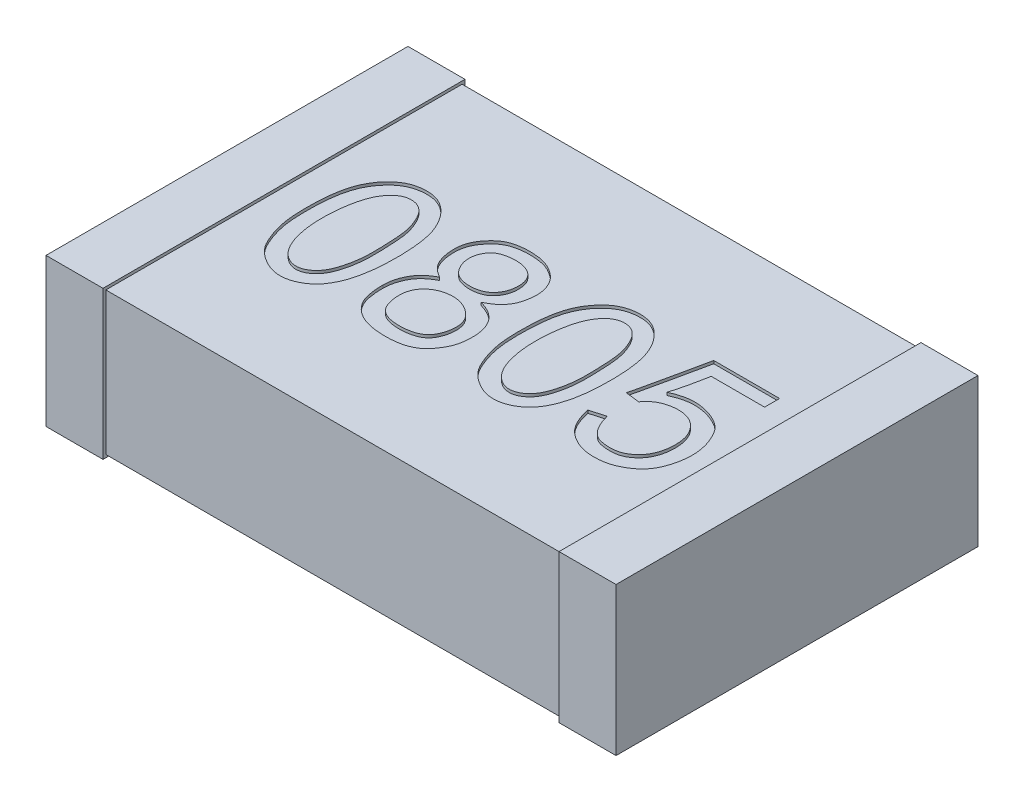
from build123d import *

# Parameters (mm, degrees)
SKETCH_1_W          = 2
SKETCH_1_H          = 1.25
EXTRUDE_1_DEPTH     = 0.5
SKETCH_2_W          = 1.27
SKETCH_2_H          = 0.52
EXTRUDE_2_DEPTH     = 0.2
SKETCH_3_W          = 1.27
SKETCH_3_H          = 0.52
EXTRUDE_3_DEPTH     = 0.2
CUT_EXTRUDE_1_DEPTH = 0.01


with BuildPart() as part:
    # 草图1 → 凸台-拉伸1 (new body)
    with BuildSketch(Plane(origin=(0, 0, 0), x_dir=(1, 0, 0), z_dir=(0, 1, 0))):
        Rectangle(SKETCH_1_W, SKETCH_1_H)
    extrude(amount=EXTRUDE_1_DEPTH)

    # 草图2 → 凸台-拉伸2 (add)
    with BuildSketch(Plane.ZY.offset(1)):
        with Locations((0, 0.25)):
            Rectangle(SKETCH_2_W, SKETCH_2_H)
    extrude(amount=-EXTRUDE_2_DEPTH)

    # 草图3 → 凸台-拉伸3 (add)
    with BuildSketch(Plane(origin=(1, 0, 0), x_dir=(0, 0, -1), z_dir=(1, 0, 0))):
        with Locations((0, 0.25)):
            Rectangle(SKETCH_3_W, SKETCH_3_H)
    extrude(amount=-EXTRUDE_3_DEPTH)

    # 草图4 → 切除-拉伸1 (cut)
    # profile 1 of 4: a face of its own
    with BuildSketch(Plane(origin=(0, 0.5, 0), x_dir=(1, 0, 0), z_dir=(0, 1, 0))):
        with BuildLine():
            add(Edge.make_bspline(
                [(-0.697551724, 0.012086435), (-0.697273285, 0.018370502), (-0.696730214, 0.030627027), (-0.695161169, 0.048498422), (-0.693266387, 0.065412192), (-0.69080292, 0.081316611), (-0.6877582, 0.09615874), (-0.68431195, 0.110016365), (-0.680329265, 0.122850712), (-0.674464846, 0.138525208), (-0.66567087, 0.156566364), (-0.653092049, 0.176394886), (-0.638475041, 0.194219333), (-0.624646887, 0.207279888), (-0.612656941, 0.216471968), (-0.603077204, 0.222440088), (-0.593012784, 0.227539397), (-0.582430676, 0.231697991), (-0.57135034, 0.234795743), (-0.559801131, 0.23708278), (-0.547744932, 0.238497576), (-0.535321613, 0.238918496), (-0.522804682, 0.238329132), (-0.510508589, 0.236409151), (-0.498643075, 0.233000694), (-0.487200036, 0.228321421), (-0.476210616, 0.222309135), (-0.465619495, 0.21501213), (-0.455552235, 0.206241697), (-0.445883363, 0.196353957), (-0.436852354, 0.185471712), (-0.428579969, 0.173804982), (-0.421100573, 0.161474107), (-0.41451386, 0.148411439), (-0.408609653, 0.134732164), (-0.403656549, 0.120314435), (-0.399558709, 0.105216828), (-0.395046346, 0.08388881), (-0.391076445, 0.055597746), (-0.388279599, 0.019792076), (-0.387641402, -0.018386797), (-0.388591689, -0.051403705), (-0.390383002, -0.078155018), (-0.392419526, -0.097558078), (-0.395154932, -0.115972347), (-0.398339269, -0.133487456), (-0.402323068, -0.15001026), (-0.407043913, -0.165558463), (-0.412144574, -0.180233637), (-0.418148327, -0.193881523), (-0.424687356, -0.206618025), (-0.432142408, -0.218279995), (-0.440218917, -0.229024955), (-0.44913098, -0.238767754), (-0.458994708, -0.247312134), (-0.469466928, -0.255070392), (-0.480828878, -0.261673544), (-0.492777795, -0.267276961), (-0.50508428, -0.271736567), (-0.517594692, -0.274643206), (-0.53007303, -0.276370796), (-0.542607227, -0.276377116), (-0.55512302, -0.275287325), (-0.56756901, -0.272420568), (-0.580098714, -0.268479087), (-0.59237652, -0.262905087), (-0.604193618, -0.256486906), (-0.615316658, -0.249579015), (-0.625441662, -0.242062239), (-0.63464953, -0.234034941), (-0.643055126, -0.22556452), (-0.650559253, -0.216570563), (-0.657084022, -0.207028167), (-0.664375332, -0.193598514), (-0.672186654, -0.176275889), (-0.680271328, -0.154938575), (-0.68687896, -0.133088019), (-0.691127802, -0.114310704), (-0.693929058, -0.098602045), (-0.695470314, -0.085724854), (-0.696809127, -0.071863065), (-0.697618267, -0.057013447), (-0.698156481, -0.041163126), (-0.698390721, -0.02430081), (-0.698140008, -0.006428462), (-0.697751281, 0.005805843), (-0.697551724, 0.012086435)],
                knots=[0, 0, 0, 0, 1.18043416, 2.302333746, 3.366253517, 4.374302266, 5.321670991, 6.208995316, 7.053297808, 7.84229274, 9.348259463, 10.810477328, 12.240076564, 13.663562249, 14.3695339, 15.072606272, 15.778577923, 16.484387009, 17.202829605, 17.934942377, 18.692112664, 19.478485278, 20.265441384, 21.040673806, 21.808439453, 22.577161074, 23.356320991, 24.155029842, 24.986154494, 25.858111265, 26.748121484, 27.637306138, 28.540117759, 29.452135788, 30.380885827, 31.334339875, 32.310628684, 33.31521083, 35.42407972, 37.666773946, 40.052062172, 42.587025658, 43.863776122, 45.083322308, 46.247467896, 47.357025429, 48.423487632, 49.435172604, 50.405897663, 51.337337341, 52.231284254, 53.090220275, 53.931690991, 54.751583713, 55.562922169, 56.377338113, 57.194202079, 58.024663732, 58.851830165, 59.645552351, 60.431282623, 61.21044254, 61.99312915, 62.783838437, 63.60230231, 64.454612977, 65.309477934, 66.125301685, 66.909862715, 67.67340185, 68.415973016, 69.147238889, 69.868837108, 70.581506411, 72.0124375, 73.431838244, 74.861437481, 76.292961888, 77.042577341, 77.855187732, 78.726196438, 79.655959089, 80.645695907, 81.702690171, 82.820655125, 84, 84, 84, 84], degree=3))
        make_face()
        with BuildLine():
            add(Edge.make_bspline(
                [(-0.636148216, 0.029630295), (-0.636812051, 0.023028505), (-0.638119831, 0.01002275), (-0.639189436, -0.009271034), (-0.639494245, -0.028018652), (-0.639215123, -0.046227686), (-0.638138697, -0.063862507), (-0.636302132, -0.080957243), (-0.633686, -0.097499894), (-0.630484086, -0.113446593), (-0.626647751, -0.12854246), (-0.622098166, -0.142582398), (-0.616919643, -0.155464127), (-0.61119098, -0.167207052), (-0.604902659, -0.177825192), (-0.597937584, -0.187258251), (-0.590491167, -0.195706903), (-0.582340871, -0.202806994), (-0.573981557, -0.208769539), (-0.565435089, -0.21340238), (-0.556840855, -0.216685213), (-0.548166053, -0.21869248), (-0.539441951, -0.219333388), (-0.530665069, -0.218712576), (-0.521900332, -0.216545779), (-0.513191274, -0.21322486), (-0.504787762, -0.208650908), (-0.496837745, -0.203127839), (-0.489506984, -0.196532112), (-0.482791604, -0.188934524), (-0.476730003, -0.180288081), (-0.471183747, -0.1707406), (-0.466313713, -0.160133725), (-0.460586972, -0.144603367), (-0.454819597, -0.123921092), (-0.44968852, -0.098076822), (-0.446662085, -0.071124618), (-0.445868586, -0.043471665), (-0.446384518, -0.015995037), (-0.447003315, 0.01062221), (-0.448491233, 0.035930332), (-0.450271976, 0.0600582), (-0.453294063, 0.083113537), (-0.458863368, 0.104975587), (-0.466664328, 0.12570363), (-0.474671168, 0.142066309), (-0.482344699, 0.153943772), (-0.488393923, 0.161913208), (-0.495119117, 0.168572627), (-0.502210444, 0.174249821), (-0.509832864, 0.178571987), (-0.517917445, 0.181805069), (-0.526460656, 0.183808636), (-0.535333027, 0.184796557), (-0.544271637, 0.184623855), (-0.55305151, 0.183054961), (-0.561567097, 0.180311184), (-0.569871981, 0.176405083), (-0.577791916, 0.171118283), (-0.5854535, 0.164647733), (-0.592770418, 0.156884475), (-0.599978053, 0.148039205), (-0.606552671, 0.13776812), (-0.612633031, 0.126262575), (-0.618025178, 0.113374741), (-0.622854403, 0.099179209), (-0.627191513, 0.083676749), (-0.63083815, 0.066858036), (-0.633864215, 0.048709664), (-0.635369528, 0.036135052), (-0.636148216, 0.029630295)],
                knots=[0, 0, 0, 0, 1.378198314, 2.715098627, 4.012594964, 5.272602849, 6.497213731, 7.681415101, 8.842769074, 9.975170128, 11.059162755, 12.076494648, 13.038717388, 13.940857576, 14.788360499, 15.598271168, 16.373595835, 17.122768248, 17.838466736, 18.502782022, 19.136468245, 19.744060339, 20.345653328, 20.947246317, 21.563841626, 22.214212994, 22.87852828, 23.546305104, 24.220743313, 24.921956094, 25.648106704, 26.41081768, 27.212668989, 28.069279432, 29.84713992, 31.666334073, 33.537864714, 35.473745168, 37.408579624, 39.246547954, 41.003985019, 42.674193204, 44.272363647, 45.827394737, 47.348405091, 48.867584295, 49.599750274, 50.283750763, 50.94125936, 51.560811542, 52.165388272, 52.754418158, 53.363720025, 53.982318455, 54.604903792, 55.213928724, 55.828148287, 56.458765578, 57.113918044, 57.800421407, 58.537638978, 59.326979919, 60.167286366, 61.066273245, 62.027297208, 63.065989643, 64.179487018, 65.369443928, 66.639232213, 68, 68, 68, 68], degree=3))
        make_face(mode=Mode.SUBTRACT)
    # profile 2 of 4: a face of its own
    with BuildSketch(Plane(origin=(0, 0.5, 0), x_dir=(1, 0, 0), z_dir=(0, 1, 0))):
        with BuildLine():
            add(Edge.make_bspline(
                [(0.050986287, 0.012086435), (0.051264726, 0.018370502), (0.051807798, 0.030627027), (0.053376843, 0.048498422), (0.055271625, 0.065412192), (0.057735091, 0.081316611), (0.060779812, 0.09615874), (0.064226062, 0.110016365), (0.068208746, 0.122850712), (0.074073165, 0.138525208), (0.082867142, 0.156566364), (0.095445963, 0.176394886), (0.11006297, 0.194219333), (0.123891125, 0.207279888), (0.13588107, 0.216471968), (0.145460808, 0.222440088), (0.155525228, 0.227539397), (0.166107336, 0.231697991), (0.177187672, 0.234795743), (0.188736881, 0.23708278), (0.20079308, 0.238497576), (0.213216399, 0.238918496), (0.22573333, 0.238329132), (0.238029422, 0.236409151), (0.249894937, 0.233000694), (0.261337975, 0.228321421), (0.272327396, 0.222309135), (0.282918517, 0.21501213), (0.292985777, 0.206241697), (0.302654649, 0.196353957), (0.311685658, 0.185471712), (0.319958043, 0.173804982), (0.327437439, 0.161474107), (0.334024152, 0.148411439), (0.339928358, 0.134732164), (0.344881463, 0.120314435), (0.348979302, 0.105216828), (0.353491665, 0.08388881), (0.357461567, 0.055597746), (0.360258412, 0.019792076), (0.36089661, -0.018386797), (0.359946323, -0.051403705), (0.35815501, -0.078155018), (0.356118486, -0.097558078), (0.35338308, -0.115972347), (0.350198742, -0.133487456), (0.346214943, -0.15001026), (0.341494099, -0.165558463), (0.336393438, -0.180233637), (0.330389685, -0.193881523), (0.323850656, -0.206618025), (0.316395603, -0.218279995), (0.308319095, -0.229024955), (0.299407032, -0.238767754), (0.289543303, -0.247312134), (0.279071084, -0.255070392), (0.267709133, -0.261673544), (0.255760217, -0.267276961), (0.243453732, -0.271736567), (0.230943319, -0.274643206), (0.218464981, -0.276370796), (0.205930785, -0.276377116), (0.193414992, -0.275287325), (0.180969002, -0.272420568), (0.168439298, -0.268479087), (0.156161492, -0.262905087), (0.144344393, -0.256486906), (0.133221353, -0.249579015), (0.123096349, -0.242062239), (0.113888482, -0.234034941), (0.105482885, -0.22556452), (0.097978758, -0.216570563), (0.09145399, -0.207028167), (0.08416268, -0.193598514), (0.076351358, -0.176275889), (0.068266684, -0.154938575), (0.061659051, -0.133088019), (0.057410209, -0.114310704), (0.054608954, -0.098602045), (0.053067698, -0.085724854), (0.051728885, -0.071863065), (0.050919745, -0.057013447), (0.050381531, -0.041163126), (0.050147291, -0.02430081), (0.050398004, -0.006428462), (0.050786731, 0.005805843), (0.050986287, 0.012086435)],
                knots=[0, 0, 0, 0, 1.18043416, 2.302333746, 3.366253517, 4.374302266, 5.321670991, 6.208995316, 7.053297808, 7.84229274, 9.348259463, 10.810477328, 12.240076564, 13.663562249, 14.3695339, 15.072606272, 15.778577923, 16.484387009, 17.202829605, 17.934942377, 18.692112664, 19.478485278, 20.265441384, 21.040673806, 21.808439453, 22.577161074, 23.356320991, 24.155029842, 24.986154494, 25.858111265, 26.748121484, 27.637306138, 28.540117759, 29.452135788, 30.380885827, 31.334339875, 32.310628684, 33.31521083, 35.42407972, 37.666773946, 40.052062172, 42.587025658, 43.863776122, 45.083322308, 46.247467896, 47.357025429, 48.423487632, 49.435172604, 50.405897663, 51.337337341, 52.231284254, 53.090220275, 53.931690991, 54.751583713, 55.562922169, 56.377338113, 57.194202079, 58.024663732, 58.851830165, 59.645552351, 60.431282623, 61.21044254, 61.99312915, 62.783838437, 63.60230231, 64.454612977, 65.309477934, 66.125301685, 66.909862715, 67.67340185, 68.415973016, 69.147238889, 69.868837108, 70.581506411, 72.0124375, 73.431838244, 74.861437481, 76.292961888, 77.042577341, 77.855187732, 78.726196438, 79.655959089, 80.645695907, 81.702690171, 82.820655125, 84, 84, 84, 84], degree=3))
        make_face()
        with BuildLine():
            add(Edge.make_bspline(
                [(0.112389796, 0.029630295), (0.11172596, 0.023028505), (0.110418181, 0.01002275), (0.109348575, -0.009271034), (0.109043767, -0.028018652), (0.109322888, -0.046227686), (0.110399315, -0.063862507), (0.112235879, -0.080957243), (0.114852011, -0.097499894), (0.118053926, -0.113446593), (0.121890261, -0.12854246), (0.126439846, -0.142582398), (0.131618369, -0.155464127), (0.137347032, -0.167207052), (0.143635353, -0.177825192), (0.150600428, -0.187258251), (0.158046844, -0.195706903), (0.166197141, -0.202806994), (0.174556455, -0.208769539), (0.183102923, -0.21340238), (0.191697156, -0.216685213), (0.200371958, -0.21869248), (0.209096061, -0.219333388), (0.217872942, -0.218712576), (0.22663768, -0.216545779), (0.235346738, -0.21322486), (0.24375025, -0.208650908), (0.251700267, -0.203127839), (0.259031027, -0.196532112), (0.265746408, -0.188934524), (0.271808009, -0.180288081), (0.277354265, -0.1707406), (0.282224299, -0.160133725), (0.28795104, -0.144603367), (0.293718415, -0.123921092), (0.298849492, -0.098076822), (0.301875927, -0.071124618), (0.302669426, -0.043471665), (0.302153493, -0.015995037), (0.301534697, 0.01062221), (0.300046779, 0.035930332), (0.298266036, 0.0600582), (0.295243948, 0.083113537), (0.289674644, 0.104975587), (0.281873684, 0.12570363), (0.273866843, 0.142066309), (0.266193313, 0.153943772), (0.260144089, 0.161913208), (0.253418895, 0.168572627), (0.246327568, 0.174249821), (0.238705147, 0.178571987), (0.230620567, 0.181805069), (0.222077356, 0.183808636), (0.213204984, 0.184796557), (0.204266374, 0.184623855), (0.195486502, 0.183054961), (0.186970915, 0.180311184), (0.178666031, 0.176405083), (0.170746095, 0.171118283), (0.163084512, 0.164647733), (0.155767594, 0.156884475), (0.148559958, 0.148039205), (0.141985341, 0.13776812), (0.135904981, 0.126262575), (0.130512834, 0.113374741), (0.125683608, 0.099179209), (0.121346498, 0.083676749), (0.117699861, 0.066858036), (0.114673797, 0.048709664), (0.113168484, 0.036135052), (0.112389796, 0.029630295)],
                knots=[0, 0, 0, 0, 1.378198314, 2.715098627, 4.012594964, 5.272602849, 6.497213731, 7.681415101, 8.842769074, 9.975170128, 11.059162755, 12.076494648, 13.038717388, 13.940857576, 14.788360499, 15.598271168, 16.373595835, 17.122768248, 17.838466736, 18.502782022, 19.136468245, 19.744060339, 20.345653328, 20.947246317, 21.563841626, 22.214212994, 22.87852828, 23.546305104, 24.220743313, 24.921956094, 25.648106704, 26.41081768, 27.212668989, 28.069279432, 29.84713992, 31.666334073, 33.537864714, 35.473745168, 37.408579624, 39.246547954, 41.003985019, 42.674193204, 44.272363647, 45.827394737, 47.348405091, 48.867584295, 49.599750274, 50.283750763, 50.94125936, 51.560811542, 52.165388272, 52.754418158, 53.363720025, 53.982318455, 54.604903792, 55.213928724, 55.828148287, 56.458765578, 57.113918044, 57.800421407, 58.537638978, 59.326979919, 60.167286366, 61.066273245, 62.027297208, 63.065989643, 64.179487018, 65.369443928, 66.639232213, 68, 68, 68, 68], degree=3))
        make_face(mode=Mode.SUBTRACT)
    # profile 3 of 4: a face of its own
    with BuildSketch(Plane(origin=(0, 0.5, 0), x_dir=(1, 0, 0), z_dir=(0, 1, 0))):
        with BuildLine():
            add(Edge.make_bspline(
                [(-0.329130672, -0.12382433), (-0.328931482, -0.117995656), (-0.328531045, -0.106278138), (-0.324968812, -0.088914485), (-0.319538837, -0.071705837), (-0.313166973, -0.057743429), (-0.306951757, -0.046834868), (-0.301385036, -0.039045732), (-0.295157036, -0.031625586), (-0.28826451, -0.024565917), (-0.280468315, -0.018067819), (-0.272043745, -0.011914446), (-0.262914204, -0.006112397), (-0.256419314, -0.002738045), (-0.25310728, -0.001017312)],
                knots=[0, 0, 0, 0, 1.374126598, 2.76243824, 4.166032791, 5.626085304, 6.374165685, 7.125778304, 7.881627021, 8.658683375, 9.450540369, 10.273494042, 11.119577685, 12, 12, 12, 12], degree=3))
            add(Edge.make_bspline(
                [(-0.25310728, -0.001017312), (-0.258535298, 0.002359841), (-0.268841252, 0.008771902), (-0.282200292, 0.019817785), (-0.292644159, 0.031517343), (-0.300220107, 0.043986021), (-0.305363827, 0.057228054), (-0.309247195, 0.071134882), (-0.311962746, 0.085921671), (-0.313317183, 0.101253803), (-0.313386395, 0.116521943), (-0.311891178, 0.131045176), (-0.308996628, 0.144506099), (-0.304600775, 0.156939622), (-0.298732172, 0.168600589), (-0.291494964, 0.179690531), (-0.283286707, 0.190651211), (-0.273721789, 0.200855057), (-0.263400916, 0.210250348), (-0.252307007, 0.218132544), (-0.240606233, 0.224276373), (-0.228281803, 0.228694682), (-0.215490612, 0.231891261), (-0.202163265, 0.234154709), (-0.188343538, 0.235584112), (-0.174160205, 0.235931559), (-0.160098484, 0.235646265), (-0.146533561, 0.23458336), (-0.133728703, 0.232742563), (-0.121408574, 0.230168346), (-0.109284117, 0.226281048), (-0.096911018, 0.220975575), (-0.08442865, 0.21361616), (-0.071493095, 0.2052439), (-0.059217547, 0.194882496), (-0.048705165, 0.182168325), (-0.039983054, 0.167506088), (-0.034444546, 0.153815276), (-0.031205053, 0.142012607), (-0.029296046, 0.132688873), (-0.028384207, 0.122967072), (-0.028119144, 0.112899061), (-0.02888187, 0.102451582), (-0.030098505, 0.091617536), (-0.032350133, 0.080458891), (-0.035200514, 0.069066106), (-0.038945325, 0.057695361), (-0.044339803, 0.046920568), (-0.051026239, 0.036774814), (-0.058927178, 0.027203809), (-0.068293222, 0.018377669), (-0.078897161, 0.01014844), (-0.090918841, 0.002659206), (-0.099544196, -0.00169815), (-0.103984473, -0.003941289)],
                knots=[0, 0, 0, 0, 1.410033332, 2.677172402, 3.812064432, 4.856127883, 5.878591605, 6.938109193, 8.03995885, 9.192064022, 10.3315345, 11.405101817, 12.408541443, 13.363710648, 14.308049618, 15.282826904, 16.283668828, 17.326789228, 18.365059226, 19.359919842, 20.322241493, 21.272612498, 22.242786748, 23.229219042, 24.254411489, 25.306713209, 26.358803724, 27.358026599, 28.307996659, 29.212919167, 30.132734509, 31.114165642, 32.177631088, 33.326839266, 34.513504529, 35.70718515, 36.950754538, 38.266204093, 38.952498493, 39.651034787, 40.363832527, 41.105058096, 41.871509902, 42.674059092, 43.510125888, 44.381738271, 45.266222349, 46.146424753, 47.03266586, 47.943741995, 48.879333301, 49.867534116, 50.90222043, 52, 52, 52, 52], degree=3))
            add(Edge.make_bspline(
                [(-0.103984473, -0.003941289), (-0.099957216, -0.005181838), (-0.092136006, -0.00759107), (-0.081084035, -0.012070494), (-0.070913001, -0.016976811), (-0.061592159, -0.0222858), (-0.053322731, -0.028374307), (-0.0457817, -0.034697274), (-0.039222902, -0.041667128), (-0.031902374, -0.051724365), (-0.024291707, -0.06536172), (-0.017855023, -0.083400982), (-0.014146417, -0.103086485), (-0.012979321, -0.123712491), (-0.013930879, -0.14395634), (-0.016083676, -0.162727291), (-0.020307249, -0.179313232), (-0.026119419, -0.193782215), (-0.033073999, -0.206433372), (-0.040126268, -0.218014742), (-0.04764199, -0.228488693), (-0.055607473, -0.237976067), (-0.064490643, -0.246527164), (-0.074841646, -0.253925133), (-0.08663482, -0.260408988), (-0.09987599, -0.266070104), (-0.114826681, -0.270553784), (-0.131538984, -0.273558502), (-0.150069659, -0.275513411), (-0.169864507, -0.276061808), (-0.189837068, -0.275496582), (-0.208869675, -0.273540136), (-0.226497666, -0.27047944), (-0.242710298, -0.266037256), (-0.257599265, -0.260371818), (-0.270967233, -0.253031712), (-0.283376449, -0.244926941), (-0.294185936, -0.235177058), (-0.303638591, -0.224483035), (-0.311538589, -0.212828721), (-0.31763492, -0.200180175), (-0.322212122, -0.186637596), (-0.325191834, -0.172132735), (-0.327472429, -0.156840273), (-0.328928611, -0.140638033), (-0.329062091, -0.129531014), (-0.329130672, -0.12382433)],
                knots=[0, 0, 0, 0, 0.834664037, 1.620974963, 2.359958192, 3.071500661, 3.742523023, 4.391885647, 5.019370884, 5.633088925, 6.853041206, 8.099687998, 9.411290177, 10.808708308, 12.183221387, 13.42351142, 14.545940998, 15.563362997, 16.504155904, 17.403380615, 18.249005911, 19.055869055, 19.855247075, 20.685085447, 21.568786071, 22.517377533, 23.533390568, 24.654269325, 25.877028168, 27.222423441, 28.574967808, 29.833297063, 31.01045681, 32.11582339, 33.159850443, 34.158288642, 35.132345709, 36.089875077, 37.032569401, 37.955047952, 38.86995275, 39.806385064, 40.780048122, 41.799705361, 42.869508764, 44, 44, 44, 44], degree=3))
        make_face()
        with BuildLine():
            add(Edge.make_bspline(
                [(-0.269243299, -0.120900353), (-0.269310398, -0.126573594), (-0.26944084, -0.137602475), (-0.267325421, -0.153609794), (-0.263516985, -0.168529116), (-0.258929231, -0.180170244), (-0.254000926, -0.18863878), (-0.249662828, -0.194402715), (-0.244640188, -0.199584444), (-0.238832516, -0.203965623), (-0.232463584, -0.20797844), (-0.225351285, -0.211262274), (-0.217549206, -0.213992014), (-0.206283051, -0.216843721), (-0.191462208, -0.218874701), (-0.173270276, -0.219608488), (-0.15473761, -0.218051672), (-0.139229115, -0.215460154), (-0.127141636, -0.212036045), (-0.118648992, -0.208832199), (-0.110903079, -0.204803607), (-0.103898864, -0.200023775), (-0.097714313, -0.194421293), (-0.092116687, -0.188235994), (-0.087316176, -0.181239816), (-0.082126549, -0.171012263), (-0.077042723, -0.157776146), (-0.073316435, -0.141509139), (-0.0718195, -0.125283435), (-0.072754274, -0.111820144), (-0.07468627, -0.101295492), (-0.07706821, -0.093686733), (-0.080393143, -0.086443291), (-0.084515355, -0.079499083), (-0.089532345, -0.072823136), (-0.095537711, -0.06659783), (-0.102283982, -0.060588914), (-0.112320484, -0.053177404), (-0.125869467, -0.045406984), (-0.143238704, -0.038772782), (-0.161470242, -0.035697567), (-0.17996318, -0.03564262), (-0.19797783, -0.038274829), (-0.214801667, -0.043542756), (-0.229883744, -0.051648985), (-0.24105527, -0.060287285), (-0.248823842, -0.068331406), (-0.253919479, -0.074783415), (-0.258461778, -0.081475761), (-0.261980277, -0.088707019), (-0.264939433, -0.096231428), (-0.267249623, -0.104117377), (-0.268622829, -0.112411677), (-0.26903454, -0.118044318), (-0.269243299, -0.120900353)],
                knots=[0, 0, 0, 0, 1.45021583, 2.819245253, 4.116311686, 5.383839525, 6.004804309, 6.61809702, 7.225519428, 7.844420058, 8.474928218, 9.148418113, 9.843660174, 10.58739695, 12.118283095, 13.661739419, 15.236493707, 16.868915606, 17.675810439, 18.447690583, 19.187171155, 19.904516724, 20.610957382, 21.317398041, 22.03474361, 22.774224182, 24.247695365, 25.650274601, 27.031710525, 28.40179887, 29.088335786, 29.76605575, 30.435671148, 31.123139383, 31.828794671, 32.567062931, 33.332561727, 34.137975047, 35.755592712, 37.313353339, 38.869799076, 40.458468512, 42.027252455, 43.511108451, 44.944907386, 46.386035674, 47.104569492, 47.801282449, 48.487819365, 49.169367754, 49.853726664, 50.555320331, 51.267473945, 52, 52, 52, 52], degree=3))
        make_face(mode=Mode.SUBTRACT)
        with BuildLine():
            add(Edge.make_bspline(
                [(-0.258955233, 0.107169822), (-0.258695853, 0.102344547), (-0.258174977, 0.092654653), (-0.254181462, 0.078350025), (-0.247677072, 0.064478105), (-0.240298127, 0.053493478), (-0.233137553, 0.045335363), (-0.226852794, 0.03997003), (-0.219891244, 0.035371267), (-0.212100547, 0.03170892), (-0.203648163, 0.028779522), (-0.194457447, 0.026718961), (-0.184550763, 0.025594006), (-0.17415987, 0.025144879), (-0.16373338, 0.025598798), (-0.153755596, 0.026720361), (-0.144455037, 0.028775738), (-0.135872099, 0.031733582), (-0.127890373, 0.035362736), (-0.120703489, 0.039996803), (-0.114114259, 0.045325224), (-0.10831919, 0.051495368), (-0.103267502, 0.058240417), (-0.098787209, 0.065270971), (-0.095058356, 0.072700365), (-0.092195554, 0.080452921), (-0.08995047, 0.088485774), (-0.088607385, 0.096841562), (-0.087816262, 0.105527247), (-0.087830169, 0.114406614), (-0.088579897, 0.123133182), (-0.089953274, 0.131448521), (-0.09209704, 0.139162879), (-0.095058463, 0.146280598), (-0.098719784, 0.152828714), (-0.103244979, 0.158690443), (-0.108326631, 0.164085396), (-0.114266761, 0.168707059), (-0.120715196, 0.172862678), (-0.127861587, 0.176174037), (-0.135447664, 0.179028211), (-0.143614047, 0.181174843), (-0.152309129, 0.182682764), (-0.161578437, 0.183534068), (-0.171384709, 0.183737384), (-0.181505163, 0.183267242), (-0.191499074, 0.182377003), (-0.200958545, 0.180771796), (-0.209641556, 0.178484182), (-0.217566809, 0.175714342), (-0.224723635, 0.172310546), (-0.231145719, 0.16835356), (-0.236716125, 0.163634393), (-0.242993918, 0.156707075), (-0.249441677, 0.147185927), (-0.254842307, 0.134636576), (-0.258414415, 0.121227609), (-0.258772407, 0.111922117), (-0.258955233, 0.107169822)],
                knots=[0, 0, 0, 0, 1.534693845, 3.081901317, 4.691243309, 6.396534232, 7.275531407, 8.139372323, 9.019120457, 9.923811509, 10.872401943, 11.862147786, 12.91556615, 14.042756034, 15.169945918, 16.234774491, 17.235732746, 18.195190674, 19.120665344, 20.019718268, 20.909987491, 21.812339702, 22.706457796, 23.589652117, 24.463374508, 25.347092071, 26.216951264, 27.114386788, 28.037289102, 28.991155695, 29.936957382, 30.823062971, 31.670776101, 32.479662527, 33.27221946, 34.051415611, 34.83171274, 35.625019215, 36.441220146, 37.268830285, 38.126995544, 39.019043232, 39.952404705, 40.933573035, 41.979631126, 43.072373492, 44.157596343, 45.172184403, 46.122722093, 47.013287973, 47.840898113, 48.641248973, 49.407885578, 50.156214404, 51.612891957, 53.043495678, 54.490119686, 56, 56, 56, 56], degree=3))
        make_face(mode=Mode.SUBTRACT)
    # profile 4 of 4: a face of its own
    with BuildSketch(Plane(origin=(0, 0.5, 0), x_dir=(1, 0, 0), z_dir=(0, 1, 0))):
        with BuildLine():
            add(Edge.make_bspline(
                [(0.463266989, -0.129672283), (0.464994653, -0.13591739), (0.468296014, -0.147851044), (0.474813037, -0.164401268), (0.48222415, -0.178789478), (0.4905947, -0.190985792), (0.499852047, -0.201020341), (0.51007159, -0.20888784), (0.52129408, -0.214594966), (0.533344042, -0.217607007), (0.545349859, -0.219218923), (0.55692555, -0.220084588), (0.567898262, -0.220293246), (0.578262795, -0.219393515), (0.588062364, -0.217693369), (0.597256934, -0.215065323), (0.605937659, -0.211777302), (0.61635755, -0.205893294), (0.628148322, -0.197428626), (0.64034578, -0.185605052), (0.650390316, -0.172338932), (0.658025846, -0.157552217), (0.663796362, -0.141672585), (0.667497261, -0.124768071), (0.669614884, -0.10702754), (0.669640458, -0.088766999), (0.667990507, -0.070743482), (0.663958326, -0.053750387), (0.657818224, -0.038154294), (0.649297283, -0.02433426), (0.639218609, -0.012227489), (0.627725353, -0.002130169), (0.614756939, 0.005538788), (0.600699571, 0.011146105), (0.585464168, 0.01427888), (0.56932134, 0.015574038), (0.552281, 0.01411697), (0.537673541, 0.011636204), (0.525967411, 0.008195067), (0.517383132, 0.004984868), (0.509226022, 0.000950598), (0.501498167, -0.003831324), (0.494243948, -0.009384394), (0.48737244, -0.01562174), (0.480829721, -0.022530577), (0.476938163, -0.027655687), (0.474962895, -0.030257078)],
                knots=[0, 0, 0, 0, 1.403509506, 2.681938941, 3.847186812, 4.904053079, 5.878231469, 6.793588087, 7.685750207, 8.585290775, 9.470393314, 10.30982016, 11.100009672, 11.845851359, 12.560986003, 13.25196324, 13.915882336, 14.567096566, 15.839407414, 17.051005178, 18.23545006, 19.428749574, 20.64387823, 21.887016089, 23.170843897, 24.508646813, 25.837452598, 27.084130207, 28.281193557, 29.453850041, 30.586740233, 31.684789218, 32.751426146, 33.836635946, 34.949110065, 36.110148403, 37.333609581, 38.6456127, 39.314033617, 39.97513508, 40.629396656, 41.282862607, 41.941599093, 42.606255263, 43.292566534, 44, 44, 44, 44], degree=3))
            Line((0.474962895, -0.030257078), (0.425255293, -0.024409125))
            add(Edge.make_bspline(
                [(0.425255293, -0.024409125), (0.42554496, -0.023398655), (0.426288291, -0.020805635), (0.427603327, -0.016098216), (0.429046608, -0.009636176), (0.431035367, -0.001568512), (0.433307368, 0.008215241), (0.435866534, 0.019711751), (0.438977439, 0.032890008), (0.44210491, 0.047805656), (0.445893551, 0.064343271), (0.449841711, 0.082586063), (0.4541977, 0.102543247), (0.458842749, 0.124168813), (0.463797018, 0.147502028), (0.469288812, 0.172486359), (0.474826152, 0.199234651), (0.478776713, 0.217597747), (0.480810849, 0.227052863)],
                knots=[0, 0, 0, 0, 0.195918666, 0.502756957, 0.910723646, 1.429643005, 2.051416563, 2.782622329, 3.624763054, 4.57489522, 5.622803535, 6.786745287, 8.053588175, 9.429911375, 10.909141366, 12.499269938, 14.197481979, 16, 16, 16, 16], degree=3))
            Line((0.480810849, 0.227052863), (0.711805001, 0.227052863))
            Line((0.711805001, 0.227052863), (0.711805001, 0.174421284))
            Line((0.711805001, 0.174421284), (0.524670498, 0.174421284))
            add(Edge.make_bspline(
                [(0.524670498, 0.174421284), (0.523445379, 0.167995395), (0.521062799, 0.155498483), (0.517544032, 0.137242042), (0.513821297, 0.120037487), (0.510187109, 0.103816622), (0.506444734, 0.088641503), (0.502944877, 0.0744157), (0.499249157, 0.061212563), (0.496673199, 0.052764881), (0.495430732, 0.04869029)],
                knots=[0, 0, 0, 0, 1.215572633, 2.36401571, 3.454665764, 4.486357605, 5.452744809, 6.358917092, 7.208452572, 8, 8, 8, 8], degree=3))
            add(Edge.make_bspline(
                [(0.495430732, 0.04869029), (0.50255047, 0.051820215), (0.516317831, 0.057872515), (0.537329368, 0.063888615), (0.557561417, 0.067431832), (0.577157763, 0.068032258), (0.596127249, 0.066320804), (0.614667493, 0.062854862), (0.632832315, 0.057493044), (0.650358843, 0.050481833), (0.666611776, 0.041906322), (0.680801603, 0.031669822), (0.692634959, 0.019871673), (0.701729401, 0.006489599), (0.708988607, -0.007457711), (0.715679246, -0.021258087), (0.720740869, -0.035291942), (0.725117884, -0.049273463), (0.728238856, -0.063549218), (0.73034755, -0.078277338), (0.731153471, -0.093564862), (0.730908458, -0.109334751), (0.729701243, -0.125500378), (0.726884855, -0.141874551), (0.722986859, -0.158487201), (0.717929355, -0.175060442), (0.711428476, -0.191009836), (0.70339345, -0.205770521), (0.693830806, -0.219057785), (0.68275839, -0.230872551), (0.670277945, -0.241290537), (0.656582578, -0.250611564), (0.64161842, -0.258886484), (0.62544349, -0.266063027), (0.607898062, -0.271644062), (0.589067097, -0.275207791), (0.568953519, -0.276607076), (0.551483527, -0.276349991), (0.537138745, -0.274822843), (0.526362756, -0.272834908), (0.515679005, -0.270185333), (0.505191783, -0.26641809), (0.494795779, -0.262004881), (0.484545323, -0.256772593), (0.474468909, -0.250666449), (0.464523697, -0.243822428), (0.454951461, -0.235882144), (0.446225834, -0.226547123), (0.438258718, -0.215933098), (0.431155413, -0.204070129), (0.424672824, -0.190997586), (0.419302654, -0.176532239), (0.414299798, -0.160924118), (0.411881379, -0.14994738), (0.41063541, -0.144292166)],
                knots=[0, 0, 0, 0, 1.450390688, 2.804604791, 4.068648926, 5.275556911, 6.452442725, 7.618143571, 8.790951587, 9.982238022, 11.136940521, 12.212542103, 13.237026736, 14.239013163, 15.218911754, 16.171529131, 17.09905193, 18.000756875, 18.904901006, 19.823593684, 20.775281061, 21.75922621, 22.766546237, 23.797944411, 24.85712428, 25.950563056, 27.029284285, 28.066718635, 29.080397459, 30.07683947, 31.08115718, 32.109159614, 33.164904064, 34.269231731, 35.407297279, 36.594115443, 37.837623493, 39.165424584, 39.850059771, 40.528130199, 41.209674166, 41.902321297, 42.605767297, 43.317013374, 44.048560119, 44.803777729, 45.569089644, 46.365200101, 47.183281588, 48.041959287, 48.943059703, 49.90294273, 50.919596225, 52, 52, 52, 52], degree=3))
            Line((0.41063541, -0.144292166), (0.463266989, -0.129672283))
        make_face()
    extrude(amount=-CUT_EXTRUDE_1_DEPTH, mode=Mode.SUBTRACT)


solid = part.part
